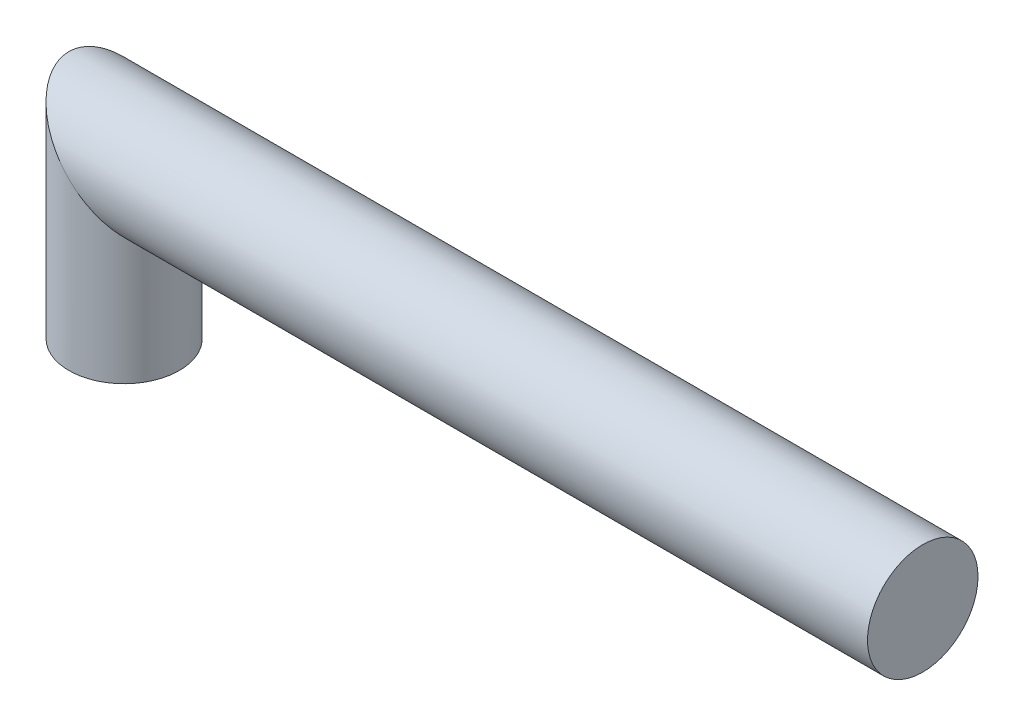
from build123d import *

# Parameters (mm, degrees)
SKETCH1_R = 10


with BuildPart() as part:
    # Sweep1: sweep along a path in Sketch2
    with BuildLine(Plane.XY) as sweep1_path:
        Line((101.83, 0), (-42.73, 0))
        Line((-42.73, 0), (-42.73, -30))
    # Sketch1 → Sweep1 (sweep)
    with BuildSketch(Plane(origin=(101.83, 0, 0), x_dir=(0, 0, -1), z_dir=(1, 0, 0))):
        Circle(SKETCH1_R)
    sweep(path=sweep1_path.line, transition=Transition.RIGHT)


solid = part.part
